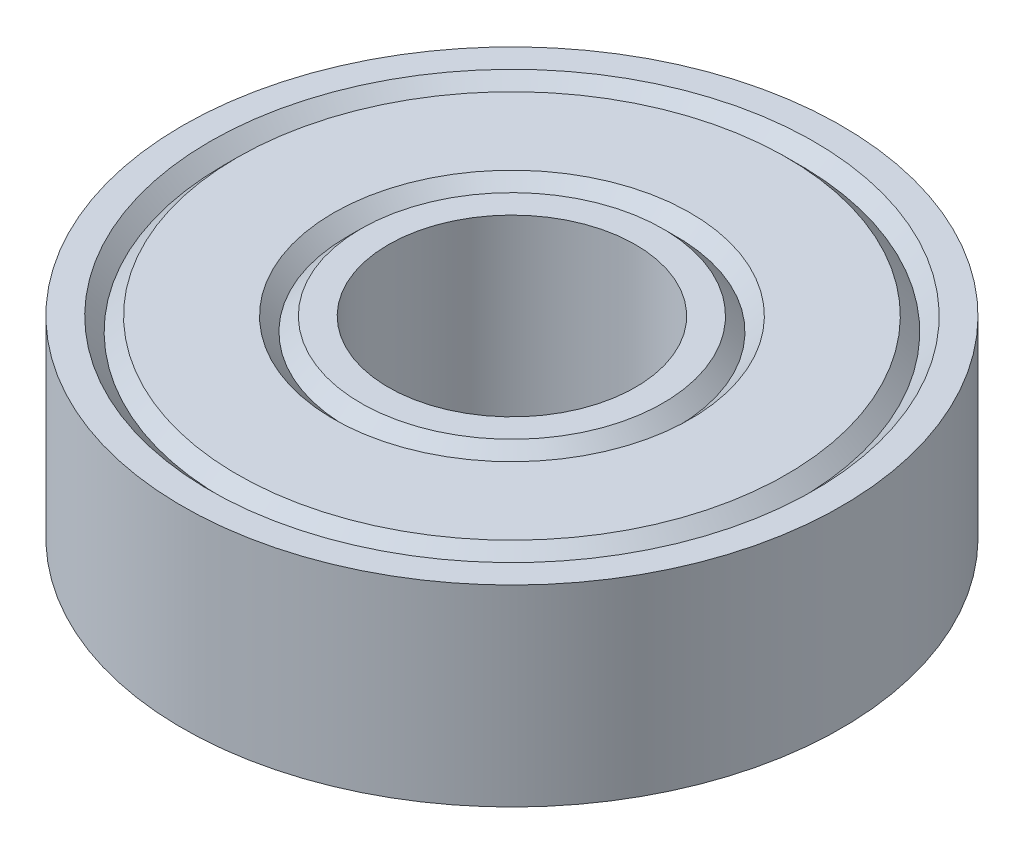
from build123d import *


with BuildPart() as part:
    # Sketch1 → Revolve1 (revolve)
    with BuildSketch(Plane.XY):
        Polygon((-4.5, 3.5), (-5.5, 3.5), (-6, 3), (-6.5, 3.5), (-10, 3.5), (-10.5, 3), (-11, 3.5), (-12, 3.5), (-12, -3.5), (-11, -3.5), (-10.5, -3), (-10, -3.5), (-6.5, -3.5), (-6, -3), (-5.5, -3.5), (-4.5, -3.5), align=None)
    revolve(axis=Axis((0, 3.5, 0), (0, -1, 0)))


solid = part.part
